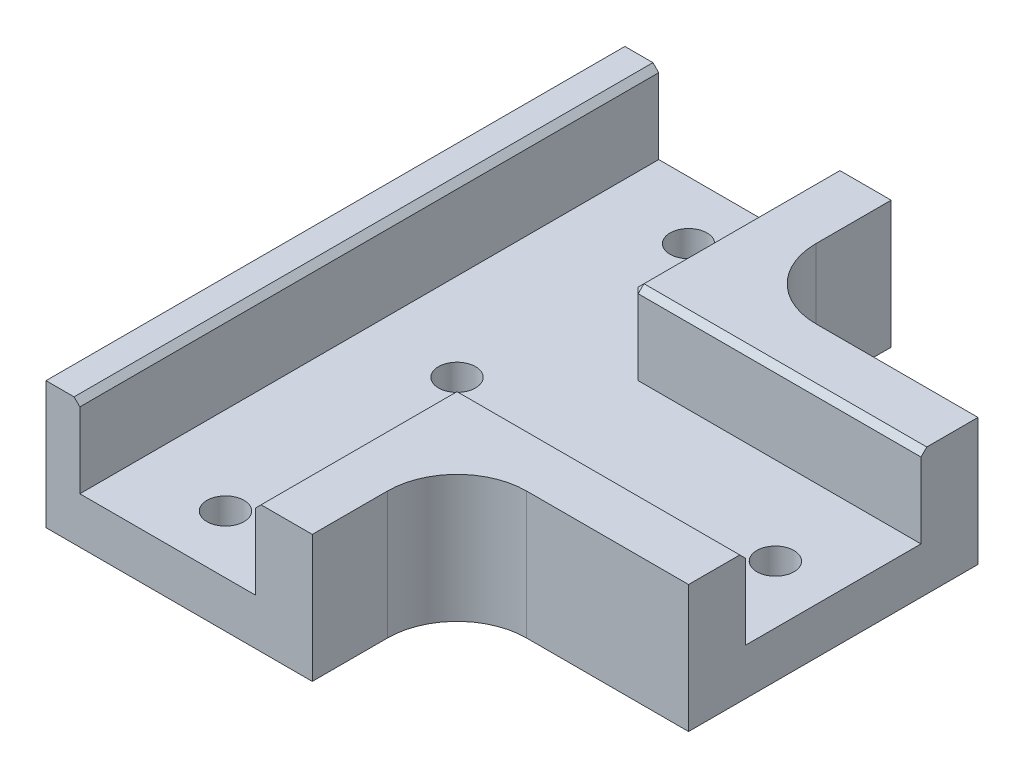
from build123d import *

# Parameters (mm, degrees)
EXTRUDE_1_DEPTH     = 4
SKETCH_2_W          = 2.925
SKETCH_2_H          = 50
EXTRUDE_2_DEPTH     = 7
SKETCH_3_R          = 1.6
CUT_EXTRUDE_1_DEPTH = 42.596273872
CHAMFER_1_SIZE      = 0.5
FILLET_1_R          = 6


with BuildPart() as part:
    # 草图1 → 凸台-拉伸1 (new body)
    with BuildSketch(Plane(origin=(0, 0, 0), x_dir=(1, 0, 0), z_dir=(0, 1, 0))):
        Polygon((-10.5, 25), (12.5, 25), (12.5, 12.5), (32.5, 12.5), (32.5, -12.5), (12.5, -12.5), (12.5, -25), (-10.5, -25), align=None)
    extrude(amount=EXTRUDE_1_DEPTH)

    # 草图2 → 凸台-拉伸2 (add)
    with BuildSketch(Plane(origin=(0, 4, 0), x_dir=(1, 0, 0), z_dir=(0, 1, 0))):
        Polygon((7.575, -25), (7.575, -7.575), (32.5, -7.575), (32.5, -12.5), (12.5, -12.5), (12.5, -25), align=None)
        Polygon((32.5, 7.575), (7.575, 7.575), (7.575, 25), (12.5, 25), (12.5, 12.5), (32.5, 12.5), align=None)
        with Locations((-9.0375, 0)):
            Rectangle(SKETCH_2_W, SKETCH_2_H)
    extrude(amount=EXTRUDE_2_DEPTH)

    # 草图3 → 切除-拉伸1 (cut, through all)
    with BuildSketch(Plane(origin=(0, 4, 0), x_dir=(1, 0, 0), z_dir=(0, 1, 0))):
        with Locations(Location((0, 0, 0), (0, 0, 270))):
            Circle(SKETCH_3_R)
        with Locations(Location((0, 20, 0), (0, 0, 270))):
            Circle(SKETCH_3_R)
        with Locations(Location((0, -20, 0), (0, 0, 270))):
            Circle(SKETCH_3_R)
        with Locations(Location((27.5, 0, 0), (0, 0, 270))):
            Circle(SKETCH_3_R)
    extrude(amount=-CUT_EXTRUDE_1_DEPTH, mode=Mode.SUBTRACT)

    # 倒角1
    chamfer_1_edges = [part.edges().sort_by_distance(p)[0] for p in [
        (7.575, 7.5, 7.575),
        (20.0375, 11, 7.575),
        (7.575, 11, 16.2875),
        (7.575, 7.5, -7.575),
        (7.575, 11, -16.2875),
        (20.0375, 11, -7.575),
        (-7.575, 11, 0),
    ]]
    chamfer(chamfer_1_edges, length=CHAMFER_1_SIZE)

    # 圆角1
    fillet_1_edges = [part.edges().sort_by_distance(p)[0] for p in [
        (12.5, 5.5, 12.5),
        (12.5, 5.5, -12.5),
    ]]
    fillet(fillet_1_edges, radius=FILLET_1_R)


solid = part.part
